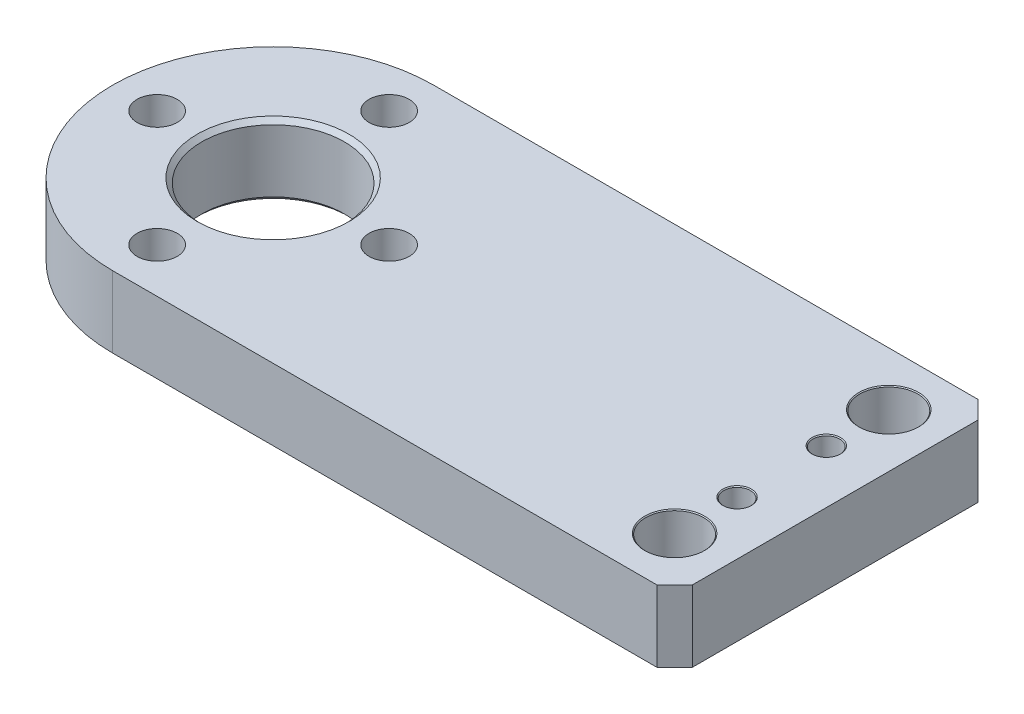
from build123d import *

# Parameters (mm, degrees)
SKETCH1_R           = 8
SKETCH1_R_2         = 2.25
BOSS_EXTRUDE1_DEPTH = 8
SKETCH2_R           = 3.25
SKETCH2_R_2         = 1.5
CUT_EXTRUDE1_DEPTH  = 67.007575323
CHAMFER1_SIZE       = 0.5
CHAMFER2_SIZE       = 0.1


with BuildPart() as part:
    # Sketch1 → Boss-Extrude1 (new body)
    with BuildSketch(Plane(origin=(0, 0, 0), x_dir=(1, 0, 0), z_dir=(0, 1, 0))):
        with BuildLine():
            Line((0, 18), (61, 18))
            Line((61, 18), (63, 16))
            Line((63, 16), (63, -16))
            Line((63, -16), (61, -18))
            Line((61, -18), (0, -18))
            ThreePointArc((0, -18), (-18, 0), (0, 18))
        make_face()
        with Locations(Location((0, 0, 0), (0, 0, 270))):
            Circle(SKETCH1_R, mode=Mode.SUBTRACT)
        with Locations(Location((0, 13, 0), (0, 0, 270))):
            Circle(SKETCH1_R_2, mode=Mode.SUBTRACT)
        with Locations(Location((13, 0, 0), (0, 0, 270))):
            Circle(SKETCH1_R_2, mode=Mode.SUBTRACT)
        with Locations(Location((0, -13, 0), (0, 0, 270))):
            Circle(SKETCH1_R_2, mode=Mode.SUBTRACT)
        with Locations(Location((-13, 0, 0), (0, 0, 270))):
            Circle(SKETCH1_R_2, mode=Mode.SUBTRACT)
    extrude(amount=BOSS_EXTRUDE1_DEPTH)

    # Sketch2 → Cut-Extrude1 (cut, through all)
    with BuildSketch(Plane(origin=(0, 8, 0), x_dir=(1, 0, 0), z_dir=(0, 1, 0))):
        with Locations(Location((57, 12, 0), (0, 0, 270))):
            Circle(SKETCH2_R)
        with Locations(Location((57, 5, 0), (0, 0, 270))):
            Circle(SKETCH2_R_2)
        with Locations(Location((57, -5, 0), (0, 0, 90))):
            Circle(SKETCH2_R_2)
        with Locations(Location((57, -12, 0), (0, 0, 90))):
            Circle(SKETCH2_R)
    extrude(amount=-CUT_EXTRUDE1_DEPTH, mode=Mode.SUBTRACT)

    # Chamfer1
    chamfer1_edges = [part.edges().sort_by_distance(p)[0] for p in [
        (0, 0, -8),
        (0, 8, -8),
    ]]
    chamfer(chamfer1_edges, length=CHAMFER1_SIZE)

    # Chamfer2
    chamfer2_edges = [part.edges().sort_by_distance(p)[0] for p in [
        (57, 0, -15.25),
        (57, 8, -15.25),
        (57, 0, -6.5),
        (57, 8, -6.5),
        (57, 0, 6.5),
        (57, 8, 6.5),
        (57, 0, 15.25),
        (57, 8, 15.25),
    ]]
    chamfer(chamfer2_edges, length=CHAMFER2_SIZE)


solid = part.part
